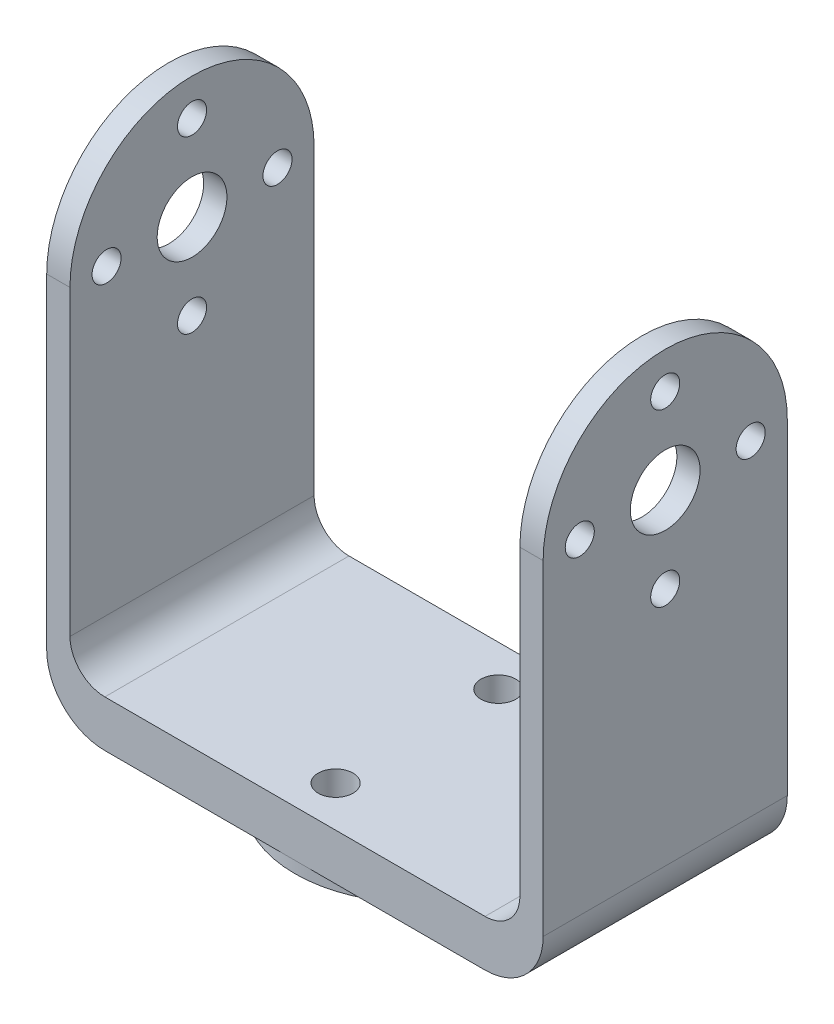
from build123d import *

# Parameters (mm, degrees)
SKETCH_1_W           = 42.7
SKETCH_1_H           = 21
SKETCH_1_R           = 1.5
EXTRUDE_1_DEPTH      = 2
SKETCH_2_R           = 1.25
SKETCH_2_R_2         = 3
EXTRUDE_2_DEPTH      = 2
EXTRUDE_3_DEPTH      = 1
EXTRUDE_3_DEPTH_BACK = 3
SKETCH_3_W           = 42.7
SKETCH_3_H           = 21
SKETCH_4_R           = 10.5
SKETCH_4_R_2         = 1.5
EXTRUDE_4_DEPTH      = 1
FILLET_1_R           = 3
FILLET_2_R           = 5
CUT_EXTRUDE_START    = -4
SKETCH_6_R           = 1.5
CUT_EXTRUDE_1_DEPTH  = 4


with BuildPart() as part:
    # 草图1 → 凸台-拉伸1 (new body)
    with BuildSketch(Plane(origin=(0, 0, 0), x_dir=(1, 0, 0), z_dir=(0, 1, 0))):
        Rectangle(SKETCH_1_W, SKETCH_1_H)
        with Locations(Location((7.5, 5, 0), (0, 0, 270))):
            Circle(SKETCH_1_R, mode=Mode.SUBTRACT)
        with Locations(Location((7.5, -5, 0), (0, 0, 90))):
            Circle(SKETCH_1_R, mode=Mode.SUBTRACT)
        with Locations(Location((-7.5, -5, 0), (0, 0, 270))):
            Circle(SKETCH_1_R, mode=Mode.SUBTRACT)
        with Locations(Location((-7.5, 5, 0), (0, 0, 90))):
            Circle(SKETCH_1_R, mode=Mode.SUBTRACT)
        with BuildLine():
            Line((8.017950723, 1.550908082), (12.912587519, 1.550908082))
            ThreePointArc((12.912587519, 1.550908082), (14.126270768, 1.145131224), (14.697546856, 0))
            ThreePointArc((14.697546856, 0), (14.126270768, -1.145131224), (12.912587519, -1.550908082))
            Line((12.912587519, -1.550908082), (8.017950723, -1.550908082))
            add(Edge.make_bspline(
                [(0, -7.407271614), (2.092471107, -7.358009404), (3.043739342, -2.951912586), (6.007732496, -1.626733157), (8.017950723, -1.550908082)],
                knots=[0, 0, 0, 0, 0.496822763, 1, 1, 1, 1], degree=3))
            add(Edge.make_bspline(
                [(0, -7.407271614), (-2.092471107, -7.358009404), (-3.043739342, -2.951912586), (-6.007732496, -1.626733157), (-8.017950723, -1.550908082)],
                knots=[0, 0, 0, 0, 0.496822763, 1, 1, 1, 1], degree=3))
            Line((-8.017950723, -1.550908082), (-12.912587519, -1.550908082))
            ThreePointArc((-12.912587519, -1.550908082), (-14.126270768, -1.145131224), (-14.697546856, 0))
            ThreePointArc((-14.697546856, 0), (-14.126270768, 1.145131224), (-12.912587519, 1.550908082))
            Line((-12.912587519, 1.550908082), (-8.017950723, 1.550908082))
            add(Edge.make_bspline(
                [(0, 7.407271614), (-2.092471107, 7.358009404), (-3.043739342, 2.951912586), (-6.007732496, 1.626733157), (-8.017950723, 1.550908082)],
                knots=[0, 0, 0, 0, 0.496822763, 1, 1, 1, 1], degree=3))
            add(Edge.make_bspline(
                [(0, 7.407271614), (2.092471107, 7.358009404), (3.043739342, 2.951912586), (6.007732496, 1.626733157), (8.017950723, 1.550908082)],
                knots=[0, 0, 0, 0, 0.496822763, 1, 1, 1, 1], degree=3))
        make_face(mode=Mode.SUBTRACT)
    extrude(amount=EXTRUDE_1_DEPTH)

    # 草图2 → 凸台-拉伸2 (add)
    with BuildSketch(Plane.ZY.offset(21.35)):
        with BuildLine():
            Line((-10.5, 2), (-10.5, 32))
            ThreePointArc((-10.5, 32), (0, 42.5), (10.5, 32))
            Line((10.5, 32), (10.5, 2))
            Line((10.5, 2), (-10.5, 2))
        make_face()
        with Locations((0, 24.65)):
            Circle(SKETCH_2_R, mode=Mode.SUBTRACT)
        with Locations((-7.35, 32)):
            Circle(SKETCH_2_R, mode=Mode.SUBTRACT)
        with Locations((0, 39.35)):
            Circle(SKETCH_2_R, mode=Mode.SUBTRACT)
        with Locations((7.35, 32)):
            Circle(SKETCH_2_R, mode=Mode.SUBTRACT)
        with Locations((0, 32)):
            Circle(SKETCH_2_R_2, mode=Mode.SUBTRACT)
    extrude_2 = extrude(amount=-EXTRUDE_2_DEPTH)

    # 镜向1: 凸台-拉伸2 across plane
    add(extrude_2.mirror(Plane(origin=(0, 0, 0), x_dir=(0, 0, 1), z_dir=(1, 0, 0))))

    # 草图3 → 凸台-拉伸3 (add, two sides: drawn at the far end of the back side and taken through both)
    with BuildSketch(Plane.XZ.offset(-EXTRUDE_3_DEPTH_BACK)):
        Rectangle(SKETCH_3_W, SKETCH_3_H)
    extrude(amount=EXTRUDE_3_DEPTH + EXTRUDE_3_DEPTH_BACK)

    # 草图4 → 凸台-拉伸4 (add)
    with BuildSketch(Plane.XZ.offset(1)):
        with Locations(Location((0, 0, 0), (0, 0, 270))):
            Circle(SKETCH_4_R)
        with Locations(Location((0, 7, 0), (0, 0, 270))):
            Circle(SKETCH_4_R_2, mode=Mode.SUBTRACT)
        with Locations(Location((0, -7, 0), (0, 0, 270))):
            Circle(SKETCH_4_R_2, mode=Mode.SUBTRACT)
    extrude(amount=EXTRUDE_4_DEPTH)

    # 圆角1
    fillet_1_edges = [part.edges().sort_by_distance(p)[0] for p in [
        (19.35, 3, 0),
        (-19.35, 3, 0),
    ]]
    fillet(fillet_1_edges, radius=FILLET_1_R)

    # 圆角2
    fillet_2_edges = [part.edges().sort_by_distance(p)[0] for p in [
        (-21.35, -1, 0),
        (21.35, -1, 0),
    ]]
    fillet(fillet_2_edges, radius=FILLET_2_R)

    # 草图6 → 切除-拉伸1 (cut)
    with BuildSketch(Plane.XZ.offset(1).offset(CUT_EXTRUDE_START)):
        with Locations(Location((0, 7, 0), (0, 0, 270))):
            Circle(SKETCH_6_R)
        with Locations(Location((0, -7, 0), (0, 0, 270))):
            Circle(SKETCH_6_R)
    extrude(amount=CUT_EXTRUDE_1_DEPTH, mode=Mode.SUBTRACT)


solid = part.part
